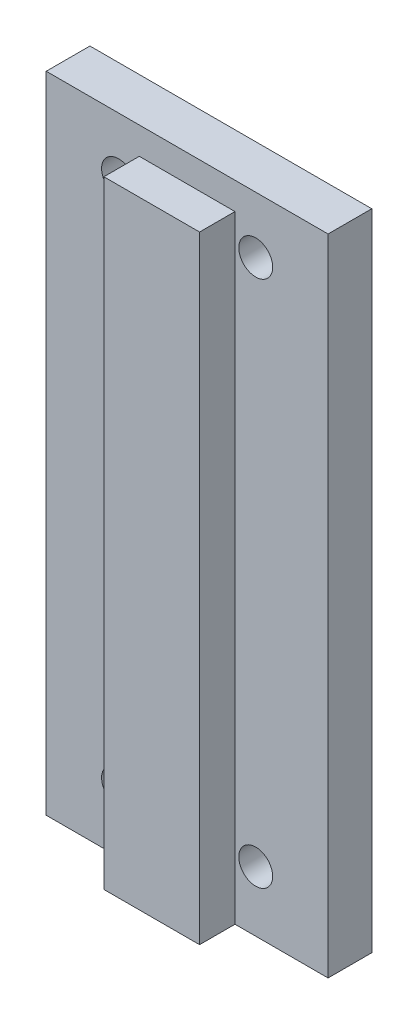
from build123d import *

# Parameters (mm, degrees)
SKETCH2_W           = 37.4
SKETCH2_H           = 85.5
BOSS_EXTRUDE1_DEPTH = 5.8
SKETCH3_W           = 12.7
SKETCH3_H           = 81.9
BOSS_EXTRUDE2_DEPTH = 4.7
SKETCH4_R           = 2.25
CUT_EXTRUDE1_DEPTH  = 5.8


with BuildPart() as part:
    # Sketch2 → Boss-Extrude1 (new body)
    with BuildSketch(Plane.XY):
        with Locations((18.7, 42.75)):
            Rectangle(SKETCH2_W, SKETCH2_H)
    extrude(amount=BOSS_EXTRUDE1_DEPTH)

    # Sketch3 → Boss-Extrude2 (add)
    with BuildSketch(Plane.XY.offset(5.8)):
        with Locations((18.7, 40.95)):
            Rectangle(SKETCH3_W, SKETCH3_H)
    extrude(amount=BOSS_EXTRUDE2_DEPTH)

    # Sketch4 → Cut-Extrude1 (cut)
    with BuildSketch(Plane(origin=(0, 0, 0), x_dir=(-1, 0, 0), z_dir=(0, 0, -1))):
        with Locations((-27.8, 78)):
            Circle(SKETCH4_R)
        with Locations((-9.6, 78)):
            Circle(SKETCH4_R)
        with Locations((-9.6, 8)):
            Circle(SKETCH4_R)
        with Locations((-27.8, 8)):
            Circle(SKETCH4_R)
    extrude(amount=-CUT_EXTRUDE1_DEPTH, mode=Mode.SUBTRACT)


solid = part.part
